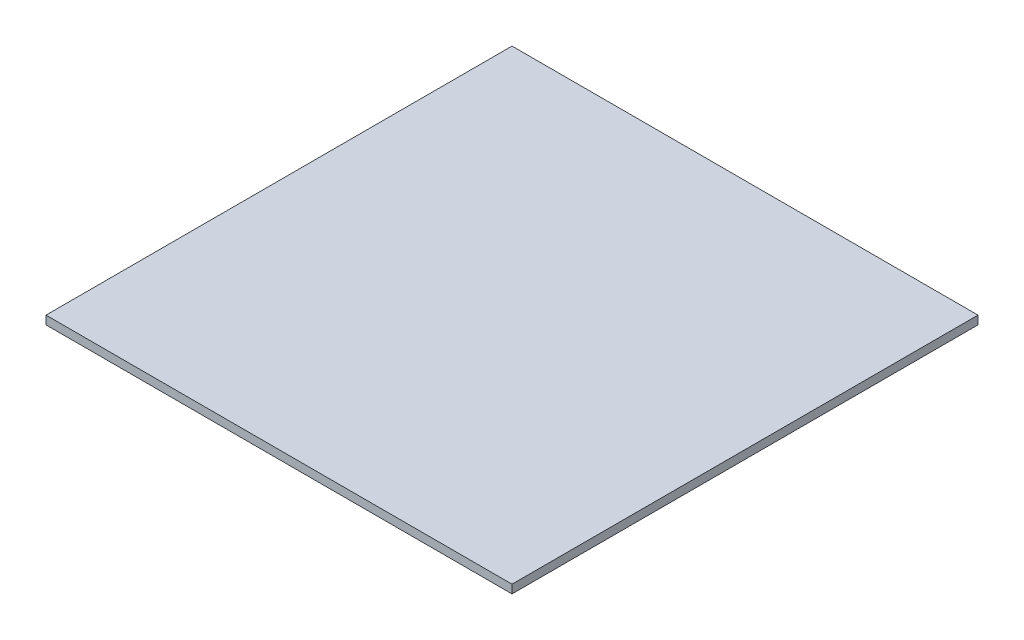
from build123d import *

# Parameters (mm, degrees)
SKETCH1_W           = 220
SKETCH1_H           = 220
BOSS_EXTRUDE1_DEPTH = 4


with BuildPart() as part:
    # Sketch1 → Boss-Extrude1 (new body)
    with BuildSketch(Plane(origin=(0, 0, 0), x_dir=(1, 0, 0), z_dir=(0, 1, 0))):
        with Locations((110, 110)):
            Rectangle(SKETCH1_W, SKETCH1_H)
    extrude(amount=BOSS_EXTRUDE1_DEPTH)


solid = part.part
